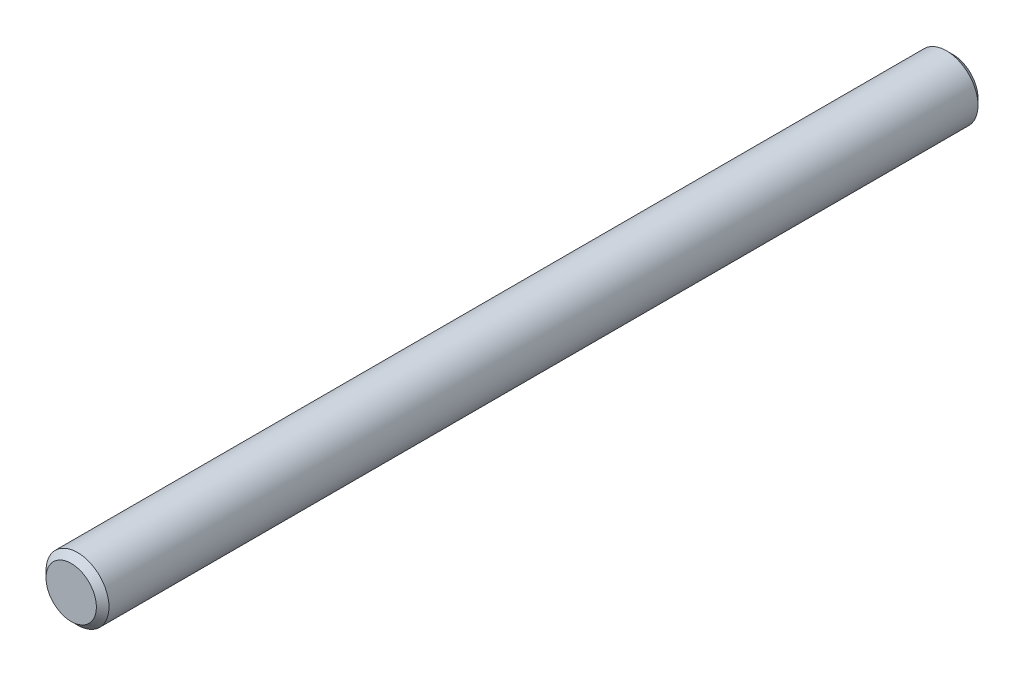
from build123d import *

# Parameters (mm, degrees)
ESQUISSE1_R      = 1
EXTRUSION1_DEPTH = 28
CHANFREIN1_SIZE  = 0.2


with BuildPart() as part:
    # Esquisse1 → Extrusion1 (new body)
    with BuildSketch(Plane.XY):
        Circle(ESQUISSE1_R)
    extrude(amount=EXTRUSION1_DEPTH)

    # Chanfrein1
    chanfrein1_edges = [part.edges().sort_by_distance(p)[0] for p in [
        (-1, 0, 0),
        (-1, 0, 28),
    ]]
    chamfer(chanfrein1_edges, length=CHANFREIN1_SIZE)


solid = part.part
